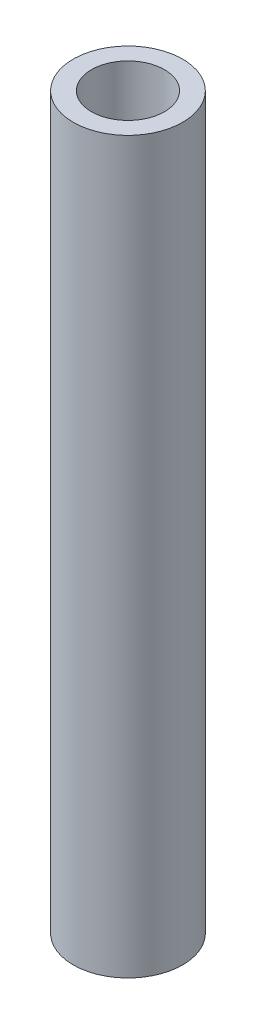
from build123d import *

# Parameters (mm, degrees)
SKETCH4_R   = 7.5
SKETCH4_R_2 = 5


with BuildPart() as part:
    # Sweep1: sweep along a path in Sketch5
    with BuildLine() as sweep1_path:  # in the path sketch's own coordinates; laid on its plane below (add() does not lay a ready-made edge on the line's plane)
        add(Edge.make_bspline(
            [(0, 0), (0, 50), (0, 100)],
            knots=[0, 0, 0, 1, 1, 1], degree=2))
    # Sketch4 → Sweep1 (sweep)
    with BuildSketch(Plane(origin=(0, 0, 0), x_dir=(1, 0, 0), z_dir=(0, 1, 0))):
        Circle(SKETCH4_R)
        Circle(SKETCH4_R_2, mode=Mode.SUBTRACT)
    sweep(path=Plane.XY * sweep1_path.line)


solid = part.part
